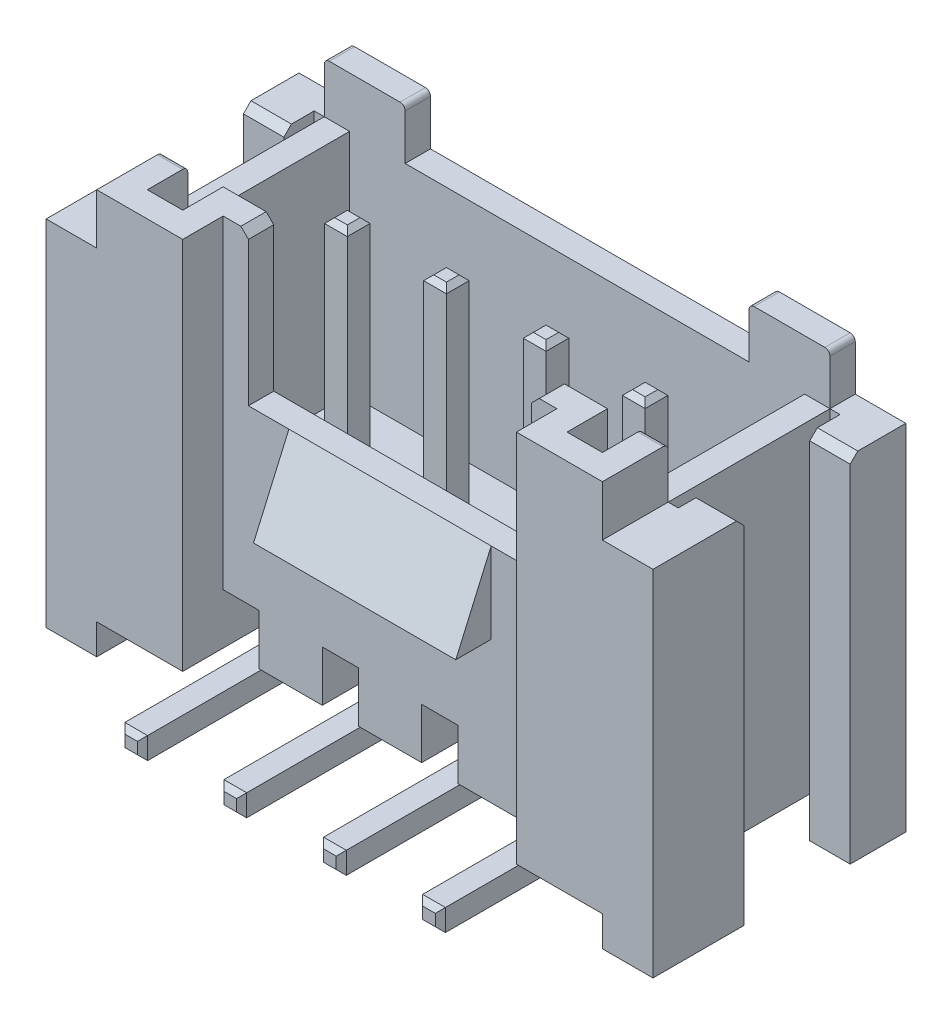
from build123d import *

# Parameters (mm, degrees)
ESQUISSE1_W             = 10
ESQUISSE1_H             = 5
BOSS_EXTRU_1_DEPTH      = 7.4
ESQUISSE2_W             = 6.6
ESQUISSE2_H             = 0.8
ENL_V_MAT_EXTRU_1_DEPTH = 8
ENL_V_MAT_EXTRU_2_DEPTH = 5.5
ESQUISSE5_W             = 6.8
ESQUISSE5_H             = 0.5
ESQUISSE5_W_2           = 0.5
ESQUISSE5_H_2           = 3.2
ENL_V_MAT_EXTRU_3_DEPTH = 1
ESQUISSE6_W             = 5.6
ESQUISSE6_H             = 0.5
ENL_V_MAT_EXTRU_4_DEPTH = 3
ESQUISSE8_W             = 6.6
ESQUISSE8_H             = 4.2
ENL_V_MAT_EXTRU_6_DEPTH = 1
BOSS_EXTRU_2_DEPTH      = 6.8
BOSS_EXTRU_3_DEPTH      = 2
BOSS_EXTRU_3_DEPTH_BACK = 2
ESQUISSE17_W            = 1.25
ESQUISSE17_H            = 4.2
BOSS_EXTRU_8_DEPTH      = 1
CHANFREIN1_SIZE         = 0.15
BOSS_EXTRU_5_DEPTH      = 0.8
BOSS_EXTRU_5_DEPTH_BACK = 6.3
ESQUISSE13_W            = 0.45
ESQUISSE13_H            = 0.45
CONG_2_R                = 0.1
CHANFREIN2_SIZE         = 0.1
ESQUISSE14_W            = 0.45
ESQUISSE14_H            = 0.43
BOSS_EXTRU_6_DEPTH      = 4.5
CHANFREIN3_SIZE         = 0.1
BOSS_EXTRU_7_DEPTH      = 7
CHANFREIN4_SIZE         = 0.15
CONG_3_R                = 0.1


with BuildPart() as part:
    # Esquisse1 → Boss.-Extru.1 (new body)
    with BuildSketch(Plane(origin=(0, 0, 0), x_dir=(1, 0, 0), z_dir=(0, 1, 0))):
        with Locations((5, 2.5)):
            Rectangle(ESQUISSE1_W, ESQUISSE1_H)
    extrude(amount=BOSS_EXTRU_1_DEPTH)

    # Esquisse2 → Enlèv. mat.-Extru.1 (cut)
    with BuildSketch(Plane(origin=(0, 7.4, 0), x_dir=(1, 0, 0), z_dir=(0, 1, 0))):
        with Locations((5, 0.4)):
            Rectangle(ESQUISSE2_W, ESQUISSE2_H)
    extrude(amount=-ENL_V_MAT_EXTRU_1_DEPTH, mode=Mode.SUBTRACT)

    # Esquisse4 → Enlèv. mat.-Extru.2 (cut)
    with BuildSketch(Plane(origin=(0, 7.4, 0), x_dir=(1, 0, 0), z_dir=(0, 1, 0))):
        Polygon((0.5, 0.5), (1.2, 0.5), (1.2, 1.3), (8.8, 1.3), (8.8, 0.5), (9.5, 0.5), (9.5, 4.5), (0.5, 4.5), align=None)
    extrude(amount=-ENL_V_MAT_EXTRU_2_DEPTH, mode=Mode.SUBTRACT)

    # Esquisse5 → Enlèv. mat.-Extru.3 (cut)
    with BuildSketch(Plane(origin=(0, 7.4, 0), x_dir=(1, 0, 0), z_dir=(0, 1, 0))):
        with Locations((5, 4.75)):
            Rectangle(ESQUISSE5_W, ESQUISSE5_H)
        with Locations((0.25, 2.9)):
            Rectangle(ESQUISSE5_W_2, ESQUISSE5_H_2)
        with Locations((9.75, 2.9)):
            Rectangle(ESQUISSE5_W_2, ESQUISSE5_H_2)
    extrude(amount=-ENL_V_MAT_EXTRU_3_DEPTH, mode=Mode.SUBTRACT)

    # Esquisse6 → Enlèv. mat.-Extru.4 (cut)
    with BuildSketch(Plane(origin=(0, 7.4, 0), x_dir=(1, 0, 0), z_dir=(0, 1, 0))):
        with Locations((5, 1.05)):
            Rectangle(ESQUISSE6_W, ESQUISSE6_H)
    extrude(amount=-ENL_V_MAT_EXTRU_4_DEPTH, mode=Mode.SUBTRACT)

    # Esquisse8 → Enlèv. mat.-Extru.6 (cut)
    with BuildSketch(Plane.XZ):
        with Locations((5, -2.9)):
            Rectangle(ESQUISSE8_W, ESQUISSE8_H)
    extrude(amount=-ENL_V_MAT_EXTRU_6_DEPTH, mode=Mode.SUBTRACT)

    # Esquisse9 → Boss.-Extru.2 (add)
    with BuildSketch(Plane(origin=(1.7, 0, 0), x_dir=(0, 0, -1), z_dir=(1, 0, 0))):
        Polygon((4.7, 1), (3.9, 0.2), (1.9, 0.2), (1.1, 1), align=None)
    extrude(amount=BOSS_EXTRU_2_DEPTH)

    # Esquisse11 → Boss.-Extru.3 (add, two sides: drawn at the far end of the back side and taken through both)
    with BuildSketch(Plane(origin=(5, 0, 0), x_dir=(0, 0, -1), z_dir=(1, 0, 0)).offset(-BOSS_EXTRU_3_DEPTH_BACK)):
        Polygon((0.8, 4.4), (0.1, 2.8), (0.8, 2.8), align=None)
    extrude(amount=BOSS_EXTRU_3_DEPTH + BOSS_EXTRU_3_DEPTH_BACK)

    # Esquisse17 → Boss.-Extru.8 (add)
    with BuildSketch(Plane(origin=(0, 1, 0), x_dir=(1, 0, 0), z_dir=(0, 1, 0))):
        with Locations((3.035, 2.9)):
            Rectangle(ESQUISSE17_W, ESQUISSE17_H)
        with Locations((5, 2.9)):
            Rectangle(ESQUISSE17_W, ESQUISSE17_H)
        with Locations((6.965, 2.9)):
            Rectangle(ESQUISSE17_W, ESQUISSE17_H)
    extrude(amount=-BOSS_EXTRU_8_DEPTH)

    # Chanfrein1
    chanfrein1_edges = [part.edges().sort_by_distance(p)[0] for p in [
        (2.2, 7.4, -1.05),
        (7.8, 7.4, -1.05),
    ]]
    chamfer(chanfrein1_edges, length=CHANFREIN1_SIZE)

    # Esquisse13 → Boss.-Extru.5 (add, two sides: drawn at the far end of the back side and taken through both)
    with BuildSketch(Plane.XZ.offset(-0.2).offset(-BOSS_EXTRU_5_DEPTH_BACK)):
        with Locations((2.055, -2.9)):
            Rectangle(ESQUISSE13_W, ESQUISSE13_H)
        with Locations((4.015, -2.9)):
            Rectangle(ESQUISSE13_W, ESQUISSE13_H)
        with Locations((5.985, -2.9)):
            Rectangle(ESQUISSE13_W, ESQUISSE13_H)
        with Locations((7.945, -2.9)):
            Rectangle(ESQUISSE13_W, ESQUISSE13_H)
    extrude(amount=BOSS_EXTRU_5_DEPTH + BOSS_EXTRU_5_DEPTH_BACK)

    # Congé2
    cong_2_edges = [part.edges().sort_by_distance(p)[0] for p in [
        (0.25, 7.4, -1.3),
        (0, 7.4, -4.75),
        (1.6, 7.4, -4.75),
        (8.4, 7.4, -4.75),
        (10, 7.4, -4.75),
        (9.75, 7.4, -1.3),
    ]]
    fillet(cong_2_edges, radius=CONG_2_R)

    # Chanfrein2
    chanfrein2_edges = [part.edges().sort_by_distance(p)[0] for p in [
        (1.83, 6.5, -2.9),
        (2.055, 6.5, -2.675),
        (2.28, 6.5, -2.9),
        (2.055, 6.5, -3.125),
        (4.24, 6.5, -2.9),
        (4.015, 6.5, -3.125),
        (3.79, 6.5, -2.9),
        (4.015, 6.5, -2.675),
        (5.76, 6.5, -2.9),
        (5.985, 6.5, -2.675),
        (6.21, 6.5, -2.9),
        (5.985, 6.5, -3.125),
        (7.945, 6.5, -2.675),
        (8.17, 6.5, -2.9),
        (7.945, 6.5, -3.125),
        (7.72, 6.5, -2.9),
    ]]
    chamfer(chanfrein2_edges, length=CHANFREIN2_SIZE)

    # Esquisse14 → Boss.-Extru.6 (add)
    with BuildSketch(Plane(origin=(0, 0, -3.125), x_dir=(-1, 0, 0), z_dir=(0, 0, -1))):
        with Locations((-7.945, -0.385)):
            Rectangle(ESQUISSE14_W, ESQUISSE14_H)
        with Locations((-5.985, -0.385)):
            Rectangle(ESQUISSE14_W, ESQUISSE14_H)
        with Locations((-4.015, -0.385)):
            Rectangle(ESQUISSE14_W, ESQUISSE14_H)
        with Locations((-2.055, -0.385)):
            Rectangle(ESQUISSE14_W, ESQUISSE14_H)
    extrude(amount=-BOSS_EXTRU_6_DEPTH)

    # Chanfrein3
    chanfrein3_edges = [part.edges().sort_by_distance(p)[0] for p in [
        (8.17, -0.385, 1.375),
        (7.945, -0.17, 1.375),
        (7.72, -0.385, 1.375),
        (7.945, -0.6, 1.375),
        (5.76, -0.385, 1.375),
        (5.985, -0.6, 1.375),
        (6.21, -0.385, 1.375),
        (5.985, -0.17, 1.375),
        (4.24, -0.385, 1.375),
        (4.015, -0.17, 1.375),
        (3.79, -0.385, 1.375),
        (4.015, -0.6, 1.375),
        (1.83, -0.385, 1.375),
        (2.055, -0.6, 1.375),
        (2.28, -0.385, 1.375),
        (2.055, -0.17, 1.375),
    ]]
    chamfer(chanfrein3_edges, length=CHANFREIN3_SIZE)

    # Esquisse16 → Boss.-Extru.7 (add)
    with BuildSketch(Plane(origin=(0, 6.4, 0), x_dir=(1, 0, 0), z_dir=(0, 1, 0))):
        Polygon((0, 1.3), (-0.2, 1.3), (-0.2, 1.8), (-1, 1.8), (-1, 1.3), (-1, 0), (0, 0), align=None)
        Polygon((-0.2, 4.5), (-0.2, 3.9), (-1, 3.9), (-1, 5), (-0.2, 5), (0, 5), (0, 4.5), align=None)
        Polygon((11, 3.9), (10.2, 3.9), (10.2, 4.5), (10, 4.5), (10, 5), (10.2, 5), (11, 5), align=None)
        Polygon((11, 1.3), (11, 1.8), (10.2, 1.8), (10.2, 1.3), (10, 1.3), (10, 0), (11, 0), align=None)
    extrude(amount=-BOSS_EXTRU_7_DEPTH)

    # Chanfrein4
    chanfrein4_edges = [part.edges().sort_by_distance(p)[0] for p in [
        (-0.6, 6.4, -1.8),
        (-0.6, 6.4, -3.9),
        (10.6, 6.4, -3.9),
        (10.6, 6.4, -1.8),
    ]]
    chamfer(chanfrein4_edges, length=CHANFREIN4_SIZE)

    # Congé3
    cong_3_edges = [part.edges().sort_by_distance(p)[0] for p in [
        (2.055, -0.6, -3.125),
        (4.015, -0.6, -3.125),
        (5.985, -0.6, -3.125),
        (7.945, -0.6, -3.125),
        (7.945, -0.17, -2.675),
        (5.985, -0.17, -2.675),
        (4.015, -0.17, -2.675),
        (2.055, -0.17, -2.675),
    ]]
    fillet(cong_3_edges, radius=CONG_3_R)


solid = part.part
